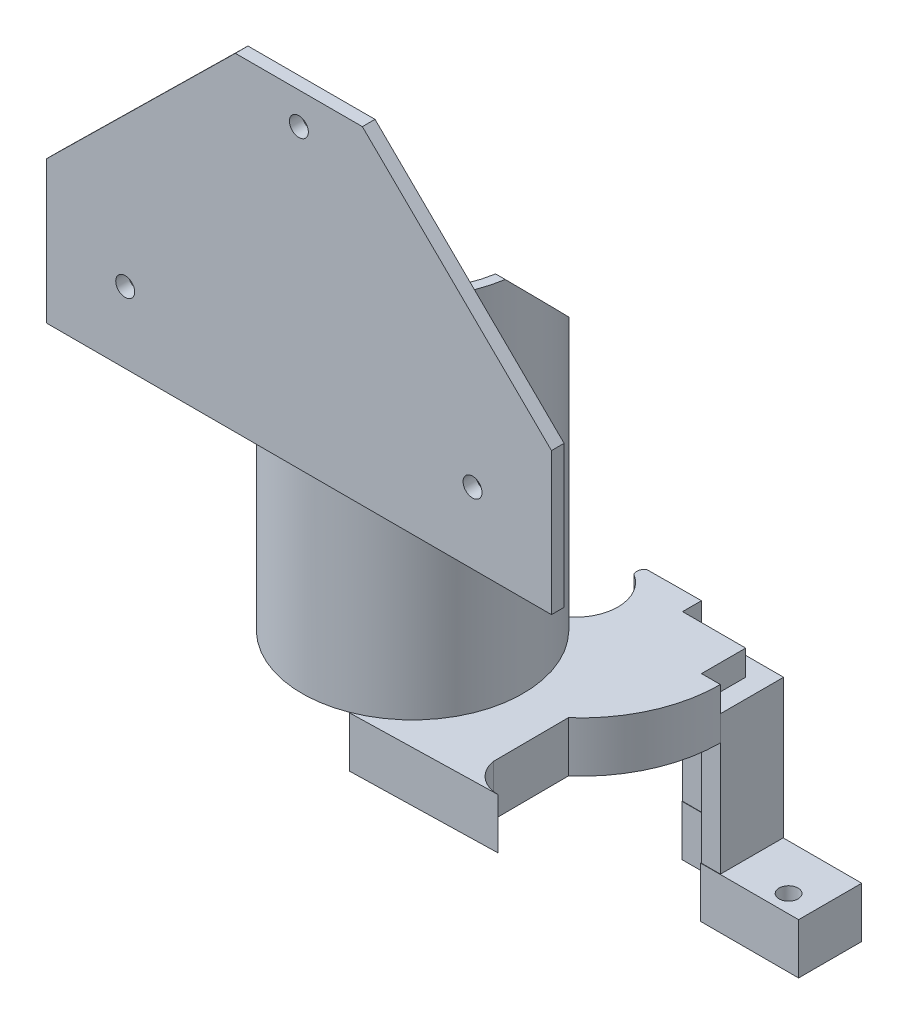
from build123d import *

# Parameters (mm, degrees)
BOSS_EXTRUDE1_DEPTH      = 53
BOSS_EXTRUDE1_DEPTH_BACK = 5
SKETCH1_R                = 17.5
SKETCH2_R                = 16
CUT_EXTRUDE1_DEPTH       = 108
SKETCH3_W                = 25
SKETCH3_H                = 20
CUT_EXTRUDE2_DEPTH       = 108
CUT_EXTRUDE3_DEPTH       = 108
CUT_EXTRUDE3_DEPTH_BACK  = 108
BOSS_EXTRUDE2_DEPTH      = 2
SKETCH10_R               = 1.5
CUT_EXTRUDE4_DEPTH       = 16
BOSS_EXTRUDE3_DEPTH      = 8
BOSS_EXTRUDE5_DEPTH      = 18
BOSS_EXTRUDE5_DEPTH_BACK = 4
SKETCH13_R               = 1.500172947
BOSS_EXTRUDE6_DEPTH      = 8


with BuildPart() as part:
    # Sketch1 → Boss-Extrude1 (new, two sides: drawn at the far end of the back side and taken through both)
    with BuildSketch(Plane(origin=(0, 0, 0), x_dir=(1, 0, 0), z_dir=(0, 1, 0)).offset(-BOSS_EXTRUDE1_DEPTH_BACK)):
        with Locations(Location((0, 0, 0), (0, 0, 270))):
            Circle(SKETCH1_R)
    extrude(amount=BOSS_EXTRUDE1_DEPTH + BOSS_EXTRUDE1_DEPTH_BACK)

    # Sketch2 → Cut-Extrude1 (cut)
    with BuildSketch(Plane(origin=(0, 53, 0), x_dir=(1, 0, 0), z_dir=(0, 1, 0))):
        with Locations(Location((0, 0, 0), (0, 0, 270))):
            Circle(SKETCH2_R)
    extrude(amount=-CUT_EXTRUDE1_DEPTH, mode=Mode.SUBTRACT)

    # Sketch3 → Cut-Extrude2 (cut)
    with BuildSketch(Plane(origin=(0, 53, 0), x_dir=(1, 0, 0), z_dir=(0, 1, 0))):
        with Locations((0, 16)):
            Rectangle(SKETCH3_W, SKETCH3_H)
    extrude(amount=-CUT_EXTRUDE2_DEPTH, mode=Mode.SUBTRACT)

    # Sketch7 → Cut-Extrude3 (cut, two sides: drawn at the far end of the back side and taken through both)
    with BuildSketch(Plane(origin=(0, 0, 0), x_dir=(0, 0, -1), z_dir=(1, 0, 0)).offset(-CUT_EXTRUDE3_DEPTH_BACK)):
        Polygon((12.247448714, 53), (12.247448714, 38), (-2.626275643, 53), align=None)
    extrude(amount=CUT_EXTRUDE3_DEPTH + CUT_EXTRUDE3_DEPTH_BACK, mode=Mode.SUBTRACT)

    # Sketch8 → Boss-Extrude2 (add)
    with BuildSketch(Plane.XY.offset(18)):
        Polygon((10.05709572, 78.023156751), (40, 48.571119754), (40, 26.071119754), (0, 26.071119754), (-40, 26.071119754), (-40, 48.571119754), (-10.05709572, 78.023156751), align=None)
    extrude(amount=-BOSS_EXTRUDE2_DEPTH)

    # Sketch10 → Cut-Extrude4 (cut)
    with BuildSketch(Plane(origin=(0, 0, 16), x_dir=(-1, 0, 0), z_dir=(0, 0, -1))):
        with Locations((-27.5, 37.321119754)):
            Circle(SKETCH10_R)
        with Locations((27.5, 37.321119754)):
            Circle(SKETCH10_R)
        with Locations((0, 73)):
            Circle(SKETCH10_R)
    extrude(amount=-CUT_EXTRUDE4_DEPTH, mode=Mode.SUBTRACT)

    # Sketch11 → Boss-Extrude3 (add)
    with BuildSketch(Plane.XZ.offset(5)):
        with BuildLine():
            Line((10.275891909, -26.805431868), (18.890882144, -26.863380934))
            Line((18.890882144, -26.863380934), (18.890882144, -23.863377119))
            Line((18.890882144, -23.863377119), (28.890882144, -23.863377119))
            Line((28.890882144, -23.863377119), (28.890882144, -16.863377119))
            Line((28.890882144, -16.863377119), (31.890882144, -16.863377119))
            ThreePointArc((31.890882144, -16.863377119), (29.928759086, -7.76088478), (24.390882144, -0.275084044))
            Line((24.390882144, -0.275084044), (24.452405581, 11.618795847))
            ThreePointArc((24.452405581, 11.618795847), (26.143620347, 14.638664645), (29.390882144, 15.836623644))
            Line((29.390882144, 15.836623644), (6.375618396, 16.386397999))
            Line((6.375618396, 16.386397999), (6.012446141, 1.182878311))
            Line((6.012446141, 1.182878311), (6.390882144, -8.863379027))
            Line((6.390882144, -8.863379027), (6.480237612, -11.760990645))
            ThreePointArc((6.480237612, -11.760990645), (7.33967567, -12.860163004), (8.724622378, -13.029680754))
            ThreePointArc((8.724622378, -13.029680754), (13.107641391, -18.70255332), (9.931897769, -25.129604841))
            ThreePointArc((9.931897769, -25.129604841), (9.756819698, -26.038761874), (10.275891909, -26.805431868))
        make_face()
    extrude(amount=BOSS_EXTRUDE3_DEPTH)


with BuildPart() as body_2:
    # Sketch12 → Boss-Extrude5 (new, two sides: drawn at the far end of the back side and taken through both)
    with BuildSketch(Plane.XZ.offset(13).offset(-BOSS_EXTRUDE5_DEPTH_BACK)):
        Polygon((18.890882144, -26.863380934), (18.890882144, -23.863377119), (28.890882144, -23.863377119), (28.890882144, -16.863377119), (31.890882144, -16.863377119), (31.890882144, -26.863380934), align=None)
    extrude(amount=BOSS_EXTRUDE5_DEPTH + BOSS_EXTRUDE5_DEPTH_BACK)

    # Sketch13 → Boss-Extrude6 (add)
    with BuildSketch(Plane.XZ.offset(31)):
        Polygon((18.822698898, -26.807587047), (18.822698898, -23.807583233), (28.822698898, -23.807583233), (28.822698898, -16.807583233), (44.322698898, -16.807583233), (44.322698898, -26.807587047), align=None)
        with Locations(Location((39.936045011, -19.607691517, 0), (0, 0, 270))):
            Circle(SKETCH13_R, mode=Mode.SUBTRACT)
    extrude(amount=BOSS_EXTRUDE6_DEPTH)


solid = Compound([part.part, body_2.part])
